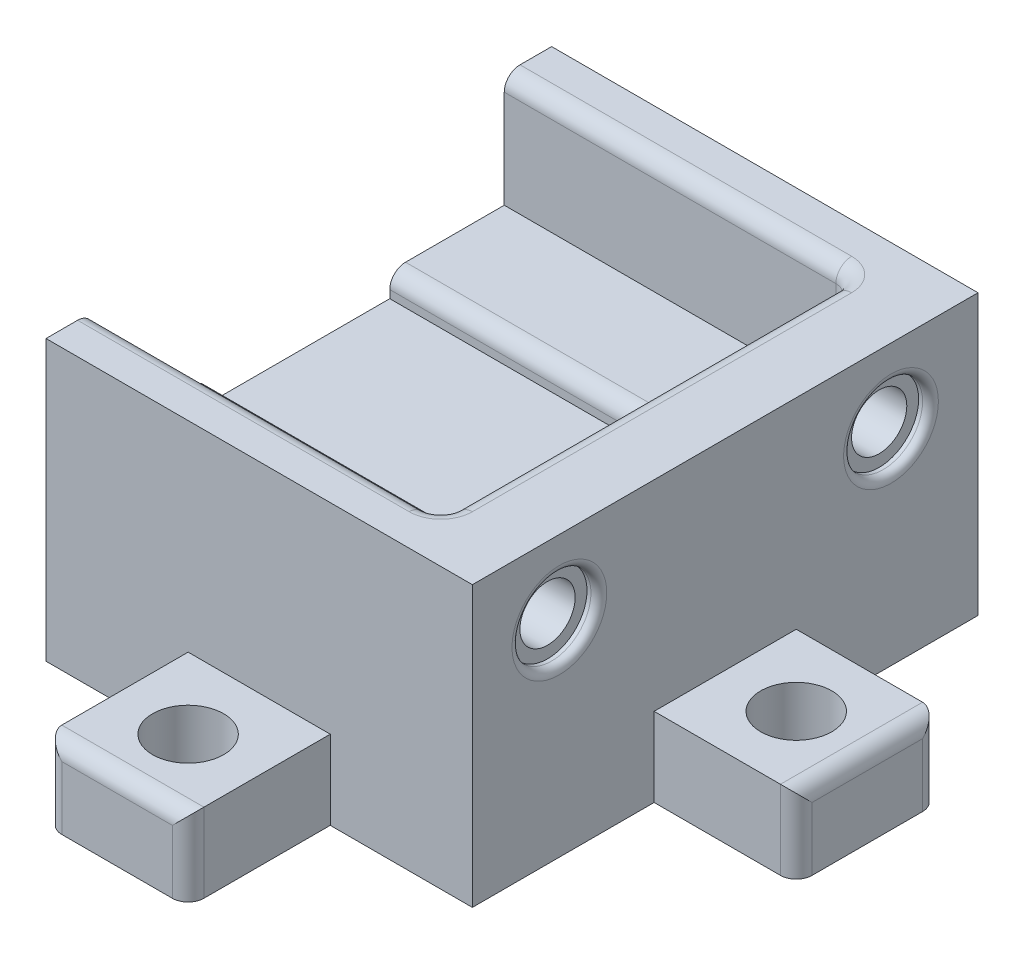
from build123d import *

# Parameters (mm, degrees)
BOSS_EXTRUDE1_DEPTH = 11
SKETCH3_W           = 22
SKETCH3_H           = 3
BOSS_EXTRUDE2_DEPTH = 17.7
BOSS_EXTRUDE3_DEPTH = 5
SKETCH5_R           = 1.75
CUT_EXTRUDE1_DEPTH  = 37.035744466
SKETCH6_W           = 9
SKETCH6_H           = 9
BOSS_EXTRUDE4_DEPTH = 5
SKETCH7_R           = 2.25
CUT_EXTRUDE2_DEPTH  = 38.573063213
FILLET1_R           = 1
SKETCH8_R           = 2.5
CUT_EXTRUDE3_DEPTH  = 0.75
FILLET2_R           = 0.5


with BuildPart() as part:
    # Sketch1 → Boss-Extrude1 (new, symmetric)
    with BuildSketch(Plane(origin=(0, 0, 0), x_dir=(0, 0, -1), z_dir=(1, 0, 0))):
        Polygon((-13.0089, 0), (13.0089, 0), (13.0089, 10.5), (5.7589, 10.5), (5.7589, 9), (-5.7589, 9), (-5.7589, 10.5), (-13.0089, 10.5), align=None)
    extrude(amount=BOSS_EXTRUDE1_DEPTH, both=True)

    # Sketch3 → Boss-Extrude2 (add)
    with BuildSketch(Plane.XZ):
        with Locations((0, -14.5089)):
            Rectangle(SKETCH3_W, SKETCH3_H)
        with Locations((0, 14.5089)):
            Rectangle(SKETCH3_W, SKETCH3_H)
    extrude(amount=-BOSS_EXTRUDE2_DEPTH)

    # Sketch4 → Boss-Extrude3 (add)
    with BuildSketch(Plane(origin=(11, 0, 0), x_dir=(0, 0, -1), z_dir=(1, 0, 0))):
        Polygon((-8.8, 17.7), (-16.0089, 17.7), (-16.0089, 0), (16.0089, 0), (16.0089, 17.7), align=None)
    extrude(amount=BOSS_EXTRUDE3_DEPTH)

    # Sketch5 → Cut-Extrude1 (cut, through all)
    with BuildSketch(Plane(origin=(16, 0, 0), x_dir=(0, 0, -1), z_dir=(1, 0, 0))):
        with Locations((-10.5, 13)):
            Circle(SKETCH5_R)
        with Locations((10.5, 13)):
            Circle(SKETCH5_R)
    extrude(amount=-CUT_EXTRUDE1_DEPTH, mode=Mode.SUBTRACT)

    # Sketch6 → Boss-Extrude4 (add)
    with BuildSketch(Plane.XZ):
        with Locations((20.5, 0)):
            Rectangle(SKETCH6_W, SKETCH6_H)
        with Locations((2.5, 20.5089)):
            Rectangle(SKETCH6_W, SKETCH6_H)
    extrude(amount=-BOSS_EXTRUDE4_DEPTH)

    # Sketch7 → Cut-Extrude2 (cut, through all)
    with BuildSketch(Plane(origin=(0, 5, 0), x_dir=(1, 0, 0), z_dir=(0, 1, 0))):
        with Locations(Location((20.5, 0, 0), (0, 0, 270))):
            Circle(SKETCH7_R)
        with Locations(Location((2.5, -20.5089, 0), (0, 0, 270))):
            Circle(SKETCH7_R)
    extrude(amount=-CUT_EXTRUDE2_DEPTH, mode=Mode.SUBTRACT)

    # Fillet1
    fillet1_edges = [part.edges().sort_by_distance(p)[0] for p in [
        (0, 10.5, 5.7589),
        (0, 10.5, -5.7589),
        (0, 17.7, -13.0089),
        (11, 14.1, -13.0089),
        (11, 14.1, 13.0089),
        (0, 17.7, 13.0089),
        (11, 17.7, 0),
        (25, 5, 0),
        (25, 2.5, 4.5),
        (25, 2.5, -4.5),
        (7, 2.5, 25.0089),
        (2.5, 5, 25.0089),
        (-2, 2.5, 25.0089),
    ]]
    fillet(fillet1_edges, radius=FILLET1_R)

    # Sketch8 → Cut-Extrude3 (cut)
    with BuildSketch(Plane(origin=(16, 0, 0), x_dir=(0, 0, -1), z_dir=(1, 0, 0))):
        with Locations((-10.5, 13)):
            Circle(SKETCH8_R)
        with Locations((10.5, 13)):
            Circle(SKETCH8_R)
    extrude(amount=-CUT_EXTRUDE3_DEPTH, mode=Mode.SUBTRACT)

    # Fillet2
    fillet2_edges = [part.edges().sort_by_distance(p)[0] for p in [
        (16, 13, 13),
        (16, 13, -8),
    ]]
    fillet(fillet2_edges, radius=FILLET2_R)


solid = part.part
